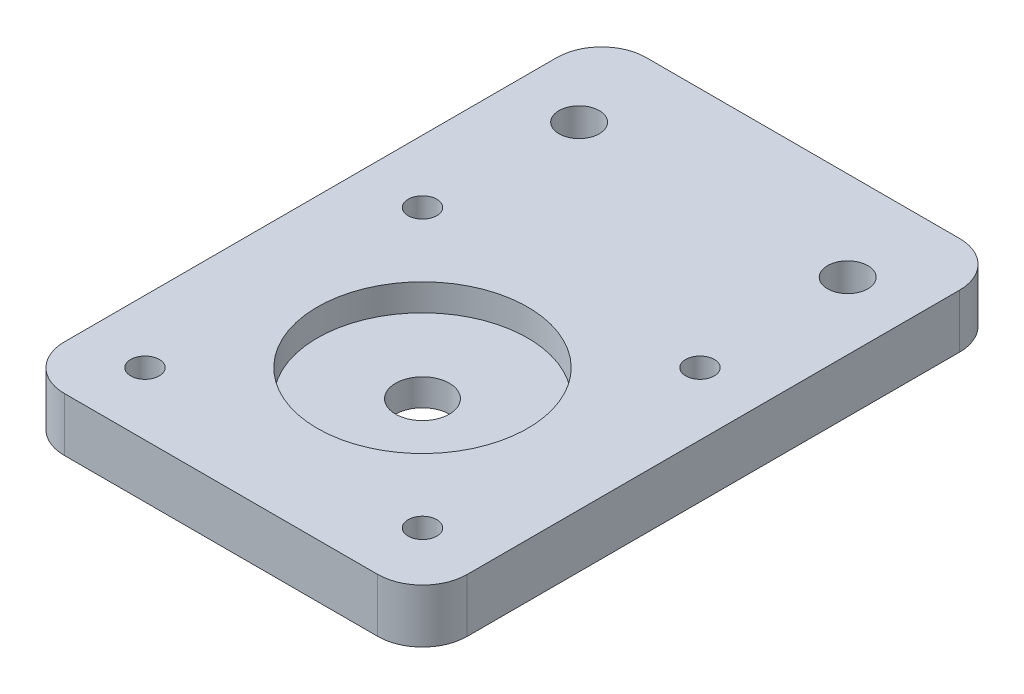
from build123d import *

# Parameters (mm, degrees)
SKETCH1_W           = 45
SKETCH1_H           = 45
SKETCH1_R           = 3
SKETCH1_R_2         = 1.6
BOSS_EXTRUDE1_DEPTH = 6
SKETCH2_R           = 11.75
CUT_EXTRUDE1_DEPTH  = 3
SKETCH5_W           = 45
SKETCH5_H           = 20
SKETCH5_R           = 2.25
BOSS_EXTRUDE2_DEPTH = 6
FILLET1_R           = 5


with BuildPart() as part:
    # Sketch1 → Boss-Extrude1 (new body)
    with BuildSketch(Plane(origin=(0, 0, 0), x_dir=(1, 0, 0), z_dir=(0, 1, 0))):
        Rectangle(SKETCH1_W, SKETCH1_H)
        with Locations(Location((0, 0, 0), (0, 0, 270))):
            Circle(SKETCH1_R, mode=Mode.SUBTRACT)
        with Locations(Location((-15.50048775, 15.50048775, 0), (0, 0, 270))):
            Circle(SKETCH1_R_2, mode=Mode.SUBTRACT)
        with Locations(Location((15.50048775, 15.50048775, 0), (0, 0, 270))):
            Circle(SKETCH1_R_2, mode=Mode.SUBTRACT)
        with Locations(Location((15.50048775, -15.50048775, 0), (0, 0, 270))):
            Circle(SKETCH1_R_2, mode=Mode.SUBTRACT)
        with Locations(Location((-15.50048775, -15.50048775, 0), (0, 0, 270))):
            Circle(SKETCH1_R_2, mode=Mode.SUBTRACT)
    extrude(amount=BOSS_EXTRUDE1_DEPTH)

    # Sketch2 → Cut-Extrude1 (cut)
    with BuildSketch(Plane(origin=(0, 6, 0), x_dir=(1, 0, 0), z_dir=(0, 1, 0))):
        with Locations(Location((0, 0, 0), (0, 0, 270))):
            Circle(SKETCH2_R)
    extrude(amount=-CUT_EXTRUDE1_DEPTH, mode=Mode.SUBTRACT)

    # Sketch5 → Boss-Extrude2 (add)
    with BuildSketch(Plane(origin=(0, 0, 0), x_dir=(1, 0, 0), z_dir=(0, 1, 0))):
        with Locations((0, 32.5)):
            Rectangle(SKETCH5_W, SKETCH5_H)
        with Locations(Location((-15, 32.5, 0), (0, 0, 90))):
            Circle(SKETCH5_R, mode=Mode.SUBTRACT)
        with Locations(Location((15, 32.5, 0), (0, 0, 90))):
            Circle(SKETCH5_R, mode=Mode.SUBTRACT)
    extrude(amount=BOSS_EXTRUDE2_DEPTH)

    # Fillet1
    fillet1_edges = [part.edges().sort_by_distance(p)[0] for p in [
        (-22.5, 3, -42.5),
        (22.5, 3, -42.5),
        (22.5, 3, 22.5),
        (-22.5, 3, 22.5),
    ]]
    fillet(fillet1_edges, radius=FILLET1_R)


solid = part.part
